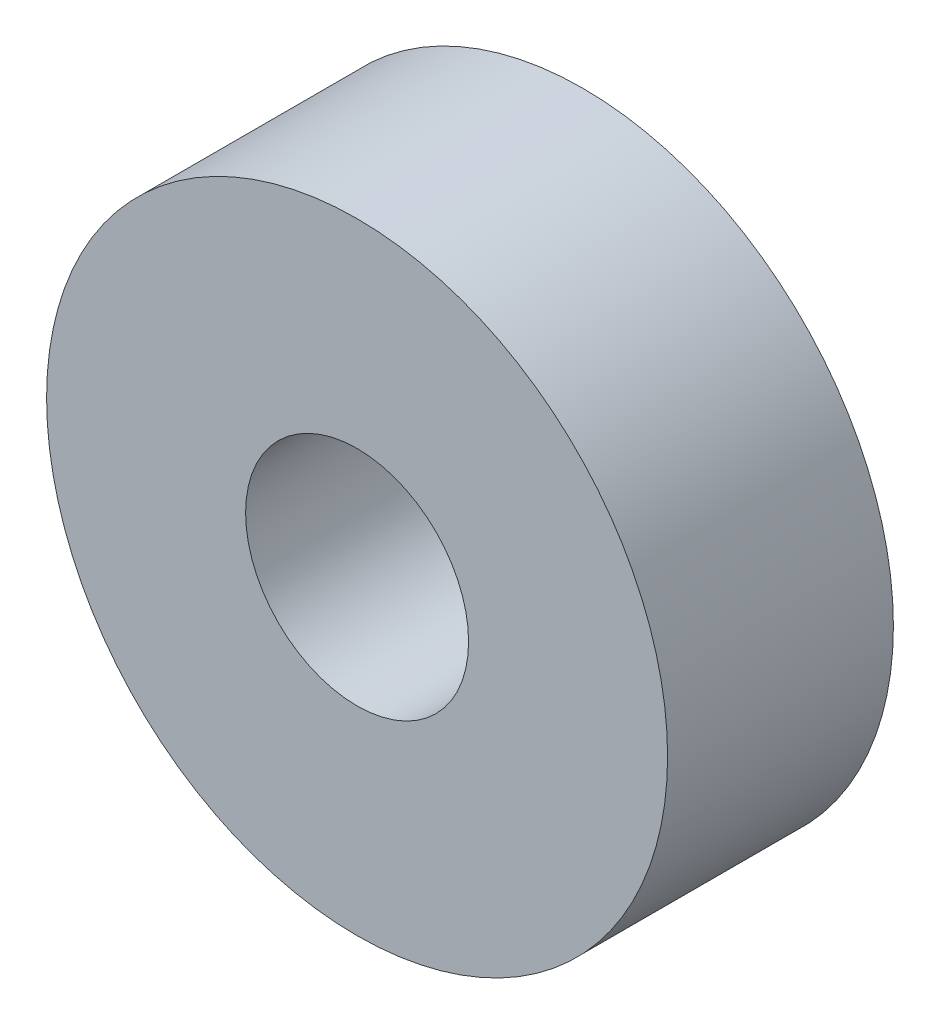
from build123d import *

# Parameters (mm, degrees)
SKETCH1_R           = 11
SKETCH1_R_2         = 3.95
BOSS_EXTRUDE1_DEPTH = 8


with BuildPart() as part:
    # Sketch1 → Boss-Extrude1 (new body)
    with BuildSketch(Plane.XY):
        Circle(SKETCH1_R)
        Circle(SKETCH1_R_2, mode=Mode.SUBTRACT)
    extrude(amount=BOSS_EXTRUDE1_DEPTH)


solid = part.part
